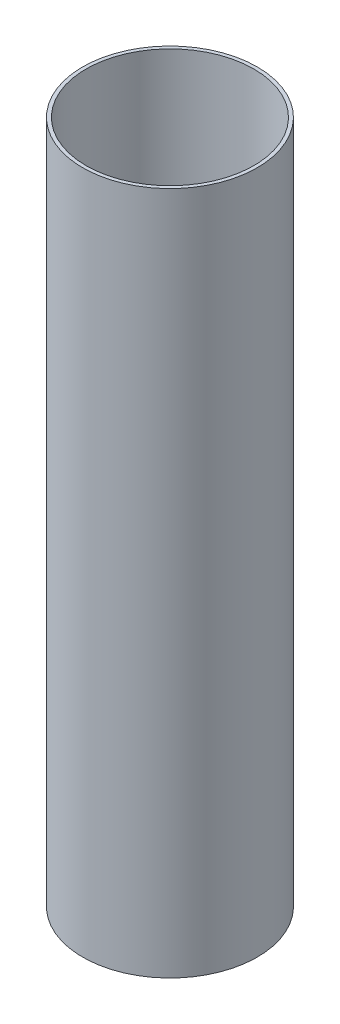
from build123d import *

# Parameters (mm, degrees)
SKETCH1_W = 1.778
SKETCH1_H = 347.98


with BuildPart() as part:
    # Sketch1 → Revolve1 (revolve)
    with BuildSketch(Plane.XY, mode=Mode.PRIVATE) as revolve1_sk:
        with Locations((43.561, 130.81)):
            Rectangle(SKETCH1_W, SKETCH1_H)
    revolve(revolve1_sk.sketch.rotate(Axis((0, 0, 0), (0, 1, 0)), 90), axis=Axis((0, 0, 0), (0, 1, 0)))


solid = part.part
